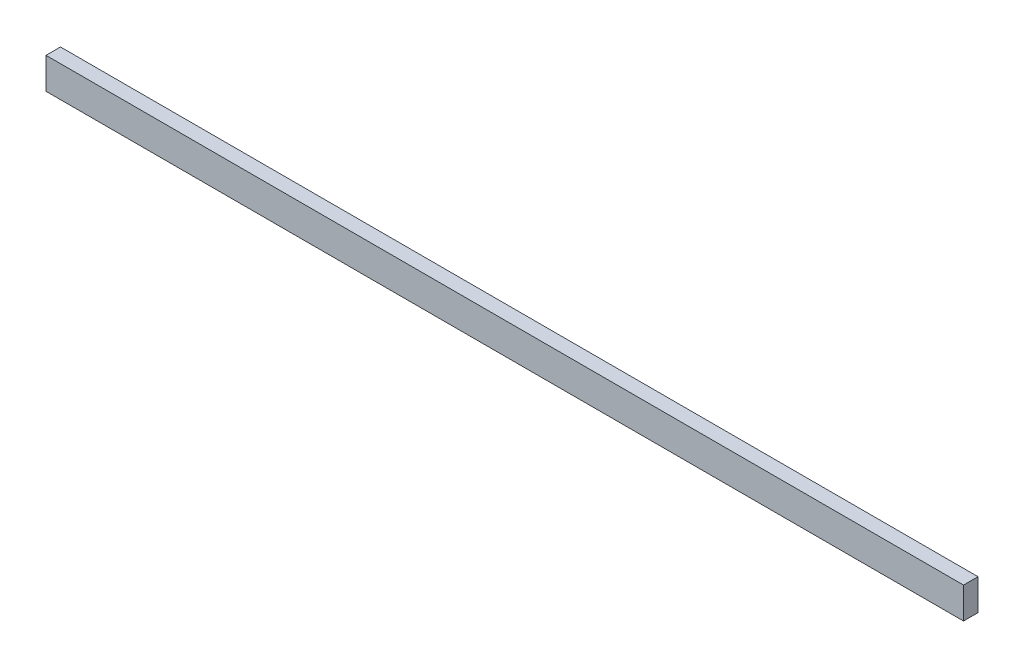
from build123d import *

# Parameters (mm, degrees)
SKETCH1_W           = 241.3
SKETCH1_H           = 3.81
BOSS_EXTRUDE1_DEPTH = 8.2


with BuildPart() as part:
    # Sketch1 → Boss-Extrude1 (new body)
    with BuildSketch(Plane(origin=(0, 0, 0), x_dir=(1, 0, 0), z_dir=(0, 1, 0))):
        Rectangle(SKETCH1_W, SKETCH1_H)
    extrude(amount=BOSS_EXTRUDE1_DEPTH)


solid = part.part
